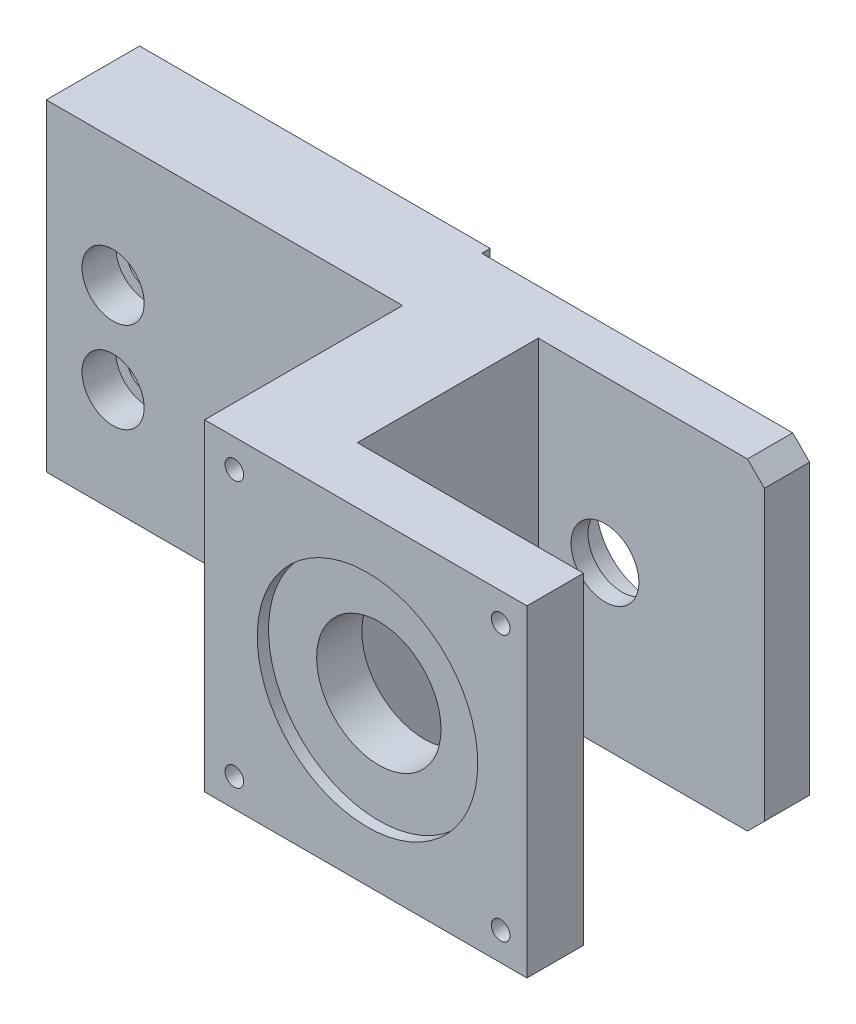
from build123d import *

# Parameters (mm, degrees)
SKETCH_1_W                   = 120
SKETCH_1_H                   = 57
EXTRUDE_1_DEPTH              = 50
SKETCH_2_W                   = 40
SKETCH_2_H                   = 32
CUT_EXTRUDE_1_DEPTH          = 142.947173272
SKETCH_3_W                   = 63
SKETCH_3_H                   = 35
CUT_EXTRUDE_2_DEPTH          = 142.947173272
SKETCH_4_W                   = 62
SKETCH_4_H                   = 57
EXTRUDE_2_DEPTH              = 1.5
SKETCH_5_R                   = 9.5
CUT_EXTRUDE_3_DEPTH          = 5
SKETCH_6_R                   = 6
CUT_EXTRUDE_4_DEPTH          = 20
SKETCH_7_R                   = 11
CUT_EXTRUDE_5_DEPTH          = 140.180638021
CHAMFER_1_SIZE               = 3
SKETCH_8_R                   = 19.5
CUT_EXTRUDE_6_DEPTH          = 2
HOLE_WIZARD_M6_1_D           = 7
HOLE_WIZARD_M6_1_CBORE_D     = 11
HOLE_WIZARD_M6_1_CBORE_DEPTH = 6
HOLE_WIZARD_M4_1_D           = 3.3
HOLE_WIZARD_M4_1_DEPTH       = 10.1
HOLE_WIZARD_M4_1_TIP         = 0.991420021


with BuildPart() as part:
    # 草图1 → 凸台-拉伸1 (new body)
    with BuildSketch(Plane.XY):
        with Locations((60, 28.5)):
            Rectangle(SKETCH_1_W, SKETCH_1_H)
    extrude(amount=EXTRUDE_1_DEPTH)

    # 草图2 → 切除-拉伸1 (cut, through all)
    with BuildSketch(Plane(origin=(0, 57, 0), x_dir=(1, 0, 0), z_dir=(0, 1, 0))):
        with Locations((100, -24)):
            Rectangle(SKETCH_2_W, SKETCH_2_H)
    extrude(amount=-CUT_EXTRUDE_1_DEPTH, mode=Mode.SUBTRACT)

    # 草图3 → 切除-拉伸2 (cut, through all)
    with BuildSketch(Plane(origin=(0, 57, 0), x_dir=(-1, 0, 0), z_dir=(0, 1, 0))):
        with Locations((-31.5, 32.5)):
            Rectangle(SKETCH_3_W, SKETCH_3_H)
    extrude(amount=-CUT_EXTRUDE_2_DEPTH, mode=Mode.SUBTRACT)

    # 草图4 → 凸台-拉伸2 (add)
    with BuildSketch(Plane(origin=(0, 0, 0), x_dir=(-1, 0, 0), z_dir=(0, 0, -1))):
        with Locations((-31, 28.5)):
            Rectangle(SKETCH_4_W, SKETCH_4_H)
    extrude(amount=EXTRUDE_2_DEPTH)

    # 草图5 → 切除-拉伸3 (cut)
    with BuildSketch(Plane(origin=(0, 0, 0), x_dir=(-1, 0, 0), z_dir=(0, 0, -1))):
        with Locations((-91.8, 28.5)):
            Circle(SKETCH_5_R)
    extrude(amount=-CUT_EXTRUDE_3_DEPTH, mode=Mode.SUBTRACT)

    # 草图6 → 切除-拉伸4 (cut)
    with BuildSketch(Plane(origin=(0, 0, 5), x_dir=(-1, 0, 0), z_dir=(0, 0, -1))):
        with Locations((-91.8, 28.5)):
            Circle(SKETCH_6_R)
    extrude(amount=-CUT_EXTRUDE_4_DEPTH, mode=Mode.SUBTRACT)

    # 草图7 → 切除-拉伸5 (cut, through all)
    with BuildSketch(Plane(origin=(0, 0, 40), x_dir=(-1, 0, 0), z_dir=(0, 0, -1))):
        with Locations((-91.8, 28.5)):
            Circle(SKETCH_7_R)
    extrude(amount=-CUT_EXTRUDE_5_DEPTH, mode=Mode.SUBTRACT)

    # 倒角1
    chamfer_1_edges = [part.edges().sort_by_distance(p)[0] for p in [
        (120, 0, 4),
        (120, 57, 4),
    ]]
    chamfer(chamfer_1_edges, length=CHAMFER_1_SIZE)

    # 草图8 → 切除-拉伸6 (cut)
    with BuildSketch(Plane.XY.offset(50)):
        with Locations((91.8, 28.5)):
            Circle(SKETCH_8_R)
    extrude(amount=-CUT_EXTRUDE_6_DEPTH, mode=Mode.SUBTRACT)

    # M6 六角凹头螺钉的柱形沉头孔1 (through all)
    with Locations(Plane.XY.offset(15)):
        with Locations((11.8, 34.5), (11.8, 18.5), (51.8, 18.5), (51.8, 34.5)):
            CounterBoreHole(HOLE_WIZARD_M6_1_D / 2, HOLE_WIZARD_M6_1_CBORE_D / 2, HOLE_WIZARD_M6_1_CBORE_DEPTH)

    # M4 螺纹孔1
    with Locations(Plane.XY.offset(50)):
        with Locations((68.25, 52), (115.35, 5), (115.35, 52), (68.25, 5)):
            Hole(HOLE_WIZARD_M4_1_D / 2, depth=HOLE_WIZARD_M4_1_DEPTH)
            with Locations((0, 0, -(HOLE_WIZARD_M4_1_DEPTH + HOLE_WIZARD_M4_1_TIP / 2))):  # 118° drill point
                Cone(0, HOLE_WIZARD_M4_1_D / 2, HOLE_WIZARD_M4_1_TIP, mode=Mode.SUBTRACT)


solid = part.part
